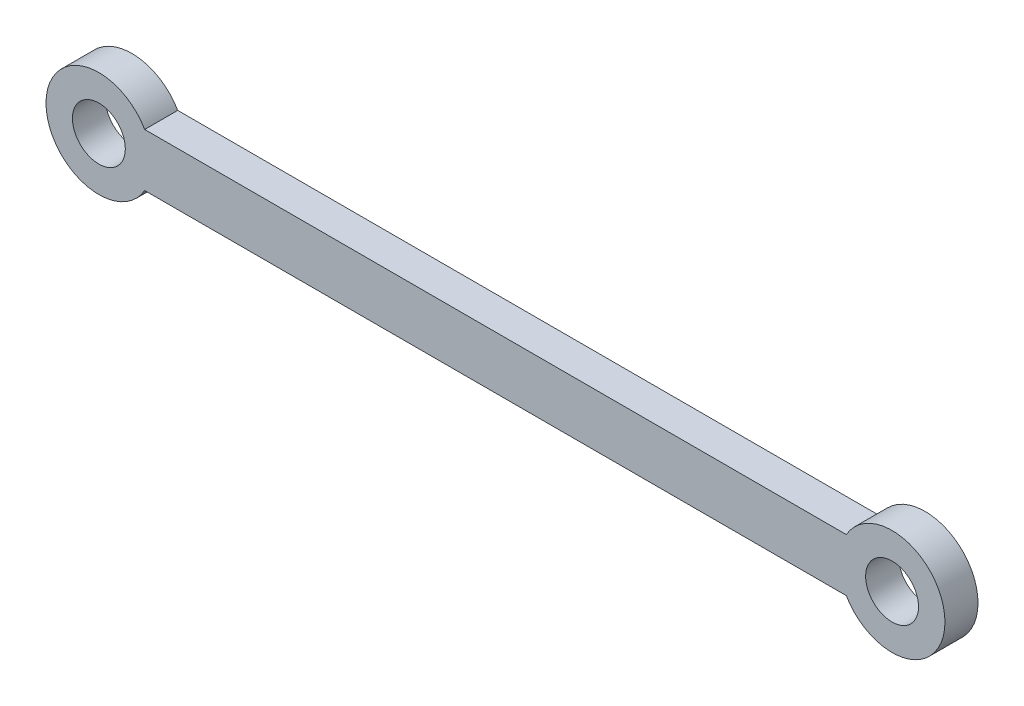
from build123d import *

# Parameters (mm, degrees)
SKETCH1_R           = 5.08
SKETCH1_W           = 76.2
SKETCH1_H           = 5.08
BOSS_EXTRUDE1_DEPTH = 3.175
SKETCH2_R           = 2.54
CUT_EXTRUDE1_DEPTH  = 82.698123754


with BuildPart() as part:
    # Sketch1 → Boss-Extrude1 (new body)
    with BuildSketch(Plane.XY):
        with Locations((0, 2.54)):
            Circle(SKETCH1_R)
        with Locations((76.2, 2.54)):
            Circle(SKETCH1_R)
        with Locations((38.1, 2.54)):
            Rectangle(SKETCH1_W, SKETCH1_H)
    extrude(amount=BOSS_EXTRUDE1_DEPTH)

    # Sketch2 → Cut-Extrude1 (cut, through all)
    with BuildSketch(Plane.XY.offset(3.175)):
        with Locations((0, 2.54)):
            Circle(SKETCH2_R)
        with Locations((76.2, 2.54)):
            Circle(SKETCH2_R)
    extrude(amount=-CUT_EXTRUDE1_DEPTH, mode=Mode.SUBTRACT)


solid = part.part
